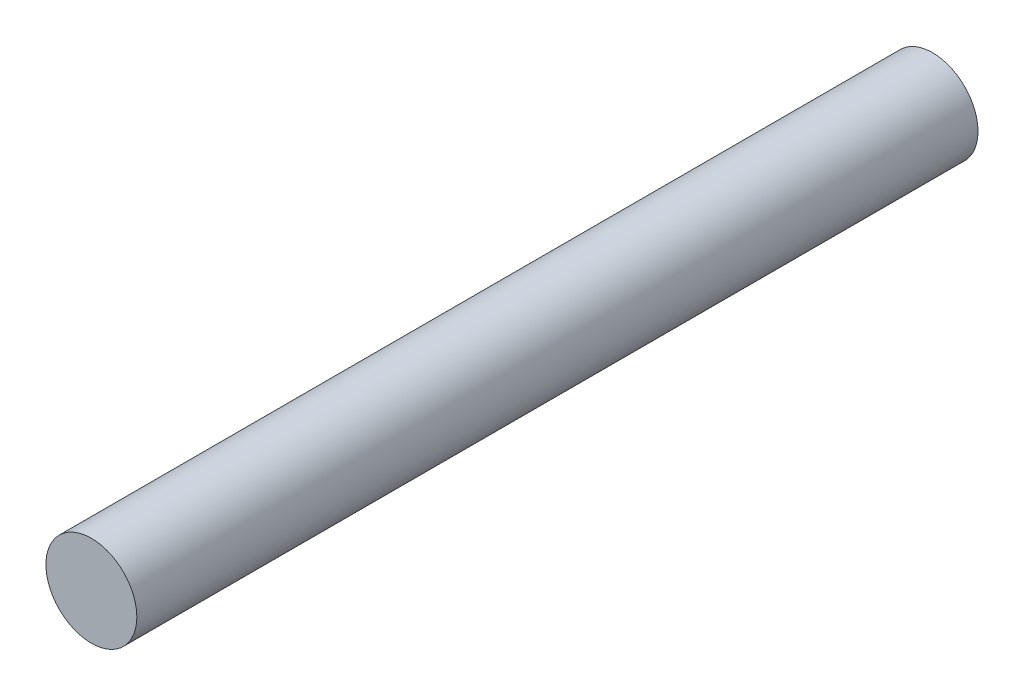
from build123d import *

# Parameters (mm, degrees)
SKETCH1_R           = 4
BOSS_EXTRUDE1_DEPTH = 74


with BuildPart() as part:
    # Sketch1 → Boss-Extrude1 (new body)
    with BuildSketch(Plane.XY):
        Circle(SKETCH1_R)
    extrude(amount=BOSS_EXTRUDE1_DEPTH)


solid = part.part
